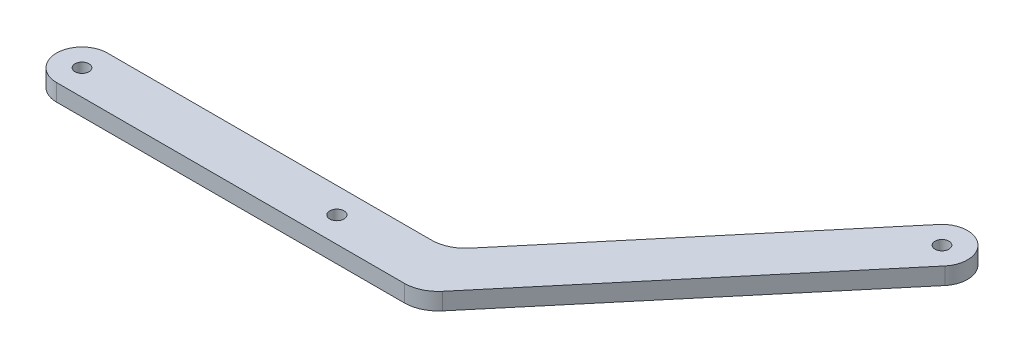
from build123d import *

# Parameters (mm, degrees)
SKETCH2_R           = 2.6035
SKETCH2_R_2         = 2.667
BOSS_EXTRUDE1_DEPTH = 6.35


with BuildPart() as part:
    # Sketch2 → Boss-Extrude1 (new body)
    with BuildSketch(Plane(origin=(0, 0, 0), x_dir=(1, 0, 0), z_dir=(0, 1, 0))):
        with BuildLine():
            Line((68.109325708, 14.275642301), (148.094743892, 109.598551777))
            ThreePointArc((148.094743892, 109.598551777), (161.513869195, 110.772573115), (162.687890534, 97.353447812))
            Line((162.687890534, 97.353447812), (76.992486596, -4.774357699))
            ThreePointArc((76.992486596, -4.774357699), (72.630974093, -8.121063952), (67.263722169, -9.310955056))
            Line((67.263722169, -9.310955056), (64.302668539, -9.310955056))
            Line((64.302668539, -9.310955056), (-62.697331461, -9.310955056))
            ThreePointArc((-62.697331461, -9.310955056), (-72.222331461, 0.214044944), (-62.697331461, 9.739044944))
            Line((-62.697331461, 9.739044944), (58.380561281, 9.739044944))
            ThreePointArc((58.380561281, 9.739044944), (63.747813205, 10.928936048), (68.109325708, 14.275642301))
        make_face()
        with Locations(Location((-62.697331461, 0.214044944, 0), (0, 0, 270))):
            Circle(SKETCH2_R, mode=Mode.SUBTRACT)
        with Locations(Location((155.391317213, 103.475999795, 0), (0, 0, 270))):
            Circle(SKETCH2_R, mode=Mode.SUBTRACT)
        with Locations(Location((32.552668539, 0.214044944, 0), (0, 0, 270))):
            Circle(SKETCH2_R_2, mode=Mode.SUBTRACT)
    extrude(amount=BOSS_EXTRUDE1_DEPTH)


solid = part.part
